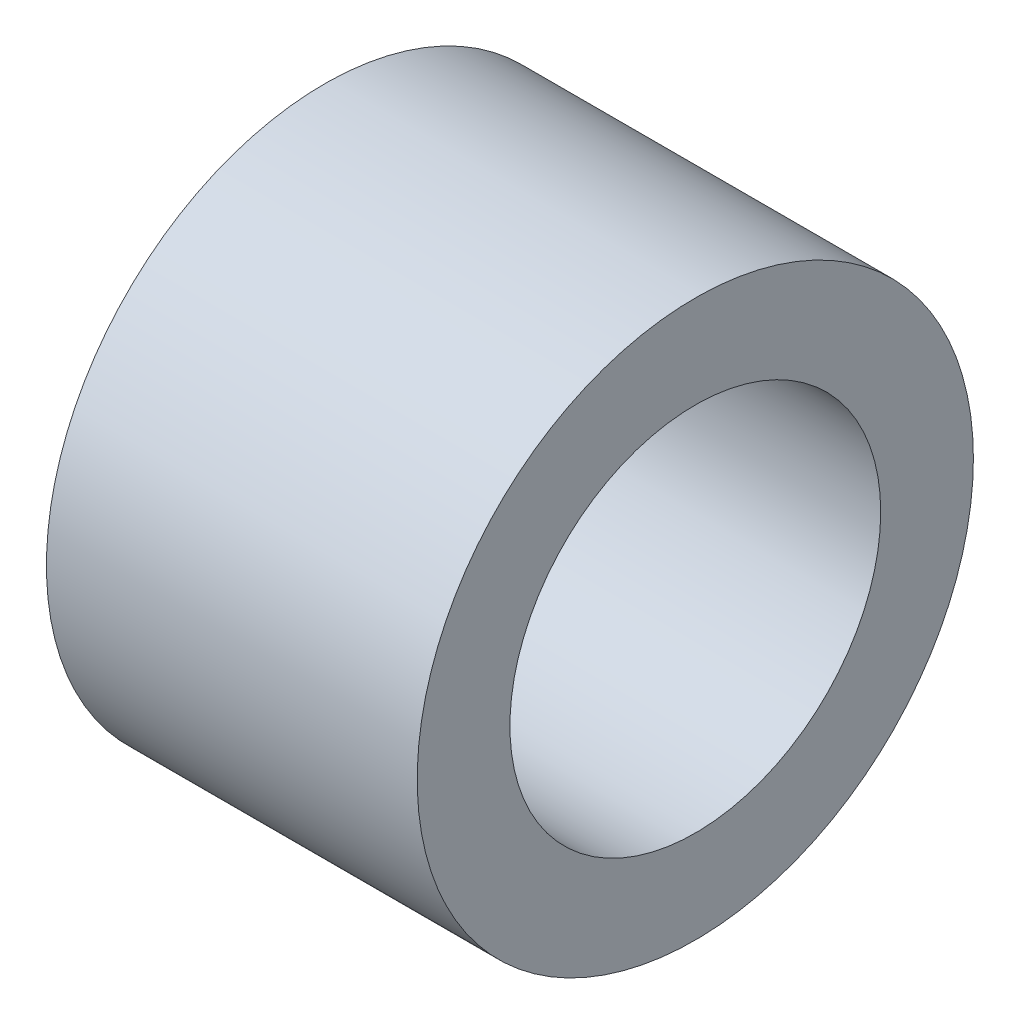
from build123d import *

# Parameters (mm, degrees)
SKETCH2_R           = 15
SKETCH2_R_2         = 10
BOSS_EXTRUDE1_DEPTH = 20


with BuildPart() as part:
    # Sketch2 → Boss-Extrude1 (new body)
    with BuildSketch(Plane(origin=(0, 0, 0), x_dir=(0, 0, -1), z_dir=(1, 0, 0))):
        Circle(SKETCH2_R)
        Circle(SKETCH2_R_2, mode=Mode.SUBTRACT)
    extrude(amount=BOSS_EXTRUDE1_DEPTH)


solid = part.part
